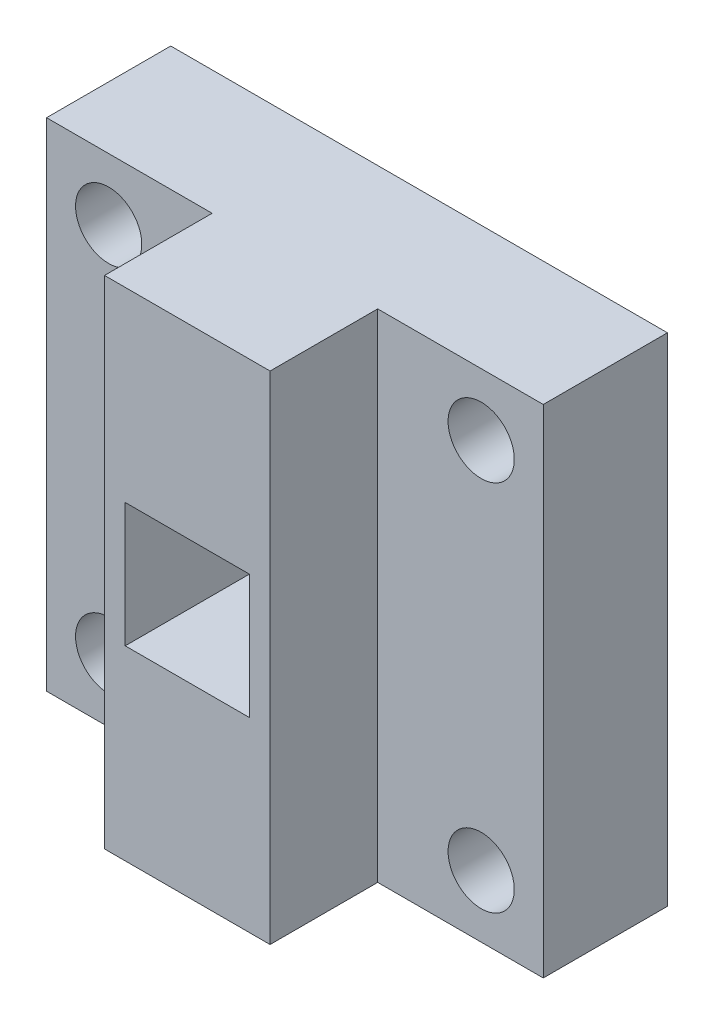
from build123d import *

# Parameters (mm, degrees)
SKETCH_1_W               = 60
SKETCH_1_H               = 60
EXTRUDE_1_DEPTH          = 15
SKETCH_2_W               = 20
SKETCH_2_H               = 60
EXTRUDE_2_DEPTH          = 13
SKETCH_3_W               = 15
SKETCH_3_H               = 15
CUT_EXTRUDE_1_DEPTH      = 51.833060109
SKETCH_5_R               = 4
CUT_EXTRUDE_3_DEPTH      = 51.833060109
MIRROR_2_COPY_1_SKETCH_R = 4
MIRROR_2_COPY_1_DEPTH    = 51.833060109


with BuildPart() as part:
    # Эскиз1 → Бобышка-Вытянуть1 (new body)
    with BuildSketch(Plane.XY):
        Rectangle(SKETCH_1_W, SKETCH_1_H)
    extrude(amount=EXTRUDE_1_DEPTH)

    # Эскиз2 → Бобышка-Вытянуть2 (add)
    with BuildSketch(Plane.XY.offset(15)):
        Rectangle(SKETCH_2_W, SKETCH_2_H)
    extrude(amount=EXTRUDE_2_DEPTH)

    # Эскиз3 → Вырез-Вытянуть1 (cut, through all)
    with BuildSketch(Plane.XY.offset(28)):
        Rectangle(SKETCH_3_W, SKETCH_3_H)
    extrude(amount=-CUT_EXTRUDE_1_DEPTH, mode=Mode.SUBTRACT)

    # Эскиз5 → Вырез-Вытянуть3 (cut, through all)
    with BuildSketch(Plane(origin=(0, 0, 0), x_dir=(-1, 0, 0), z_dir=(0, 0, -1))):
        with Locations((-22.5, -22.5)):
            Circle(SKETCH_5_R)
    cut_extrude_3 = extrude(amount=-CUT_EXTRUDE_3_DEPTH, mode=Mode.SUBTRACT)

    # Зеркальное отражение1: Вырез-Вытянуть3 across plane
    add(cut_extrude_3.mirror(Plane.ZX), mode=Mode.SUBTRACT)

    # Зеркальное отражение2: Вырез-Вытянуть3 across plane
    add(cut_extrude_3.mirror(Plane(origin=(0, 0, 0), x_dir=(0, 0, 1), z_dir=(1, 0, 0))), mode=Mode.SUBTRACT)

    # Зеркальное отражение2 copy 1 sketch → Зеркальное отражение2 copy 1 (cut, through all)
    with BuildSketch(Plane(origin=(0, 0, 0), x_dir=(1, 0, 0), z_dir=(0, 0, -1))):
        with Locations((-22.5, -22.5)):
            Circle(MIRROR_2_COPY_1_SKETCH_R)
    extrude(amount=-MIRROR_2_COPY_1_DEPTH, mode=Mode.SUBTRACT)


solid = part.part
